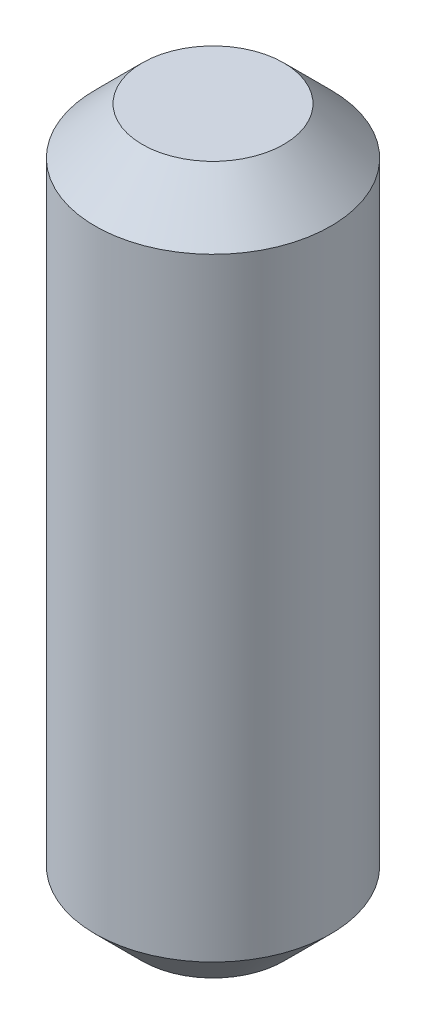
from build123d import *

# Parameters (mm, degrees)
SKETCH1_R           = 3.175
BOSS_EXTRUDE1_DEPTH = 19.05
CHAMFER1_SIZE       = 1.27


with BuildPart() as part:
    # Sketch1 → Boss-Extrude1 (new body)
    with BuildSketch(Plane(origin=(0, 0, 0), x_dir=(1, 0, 0), z_dir=(0, 1, 0))):
        with Locations(Location((0, 0, 0), (0, 0, 90))):
            Circle(SKETCH1_R)
    extrude(amount=BOSS_EXTRUDE1_DEPTH)

    # Chamfer1
    chamfer1_edges = [part.edges().sort_by_distance(p)[0] for p in [
        (0, 0, 3.175),
        (0, 19.05, 3.175),
    ]]
    chamfer(chamfer1_edges, length=CHAMFER1_SIZE)


solid = part.part
